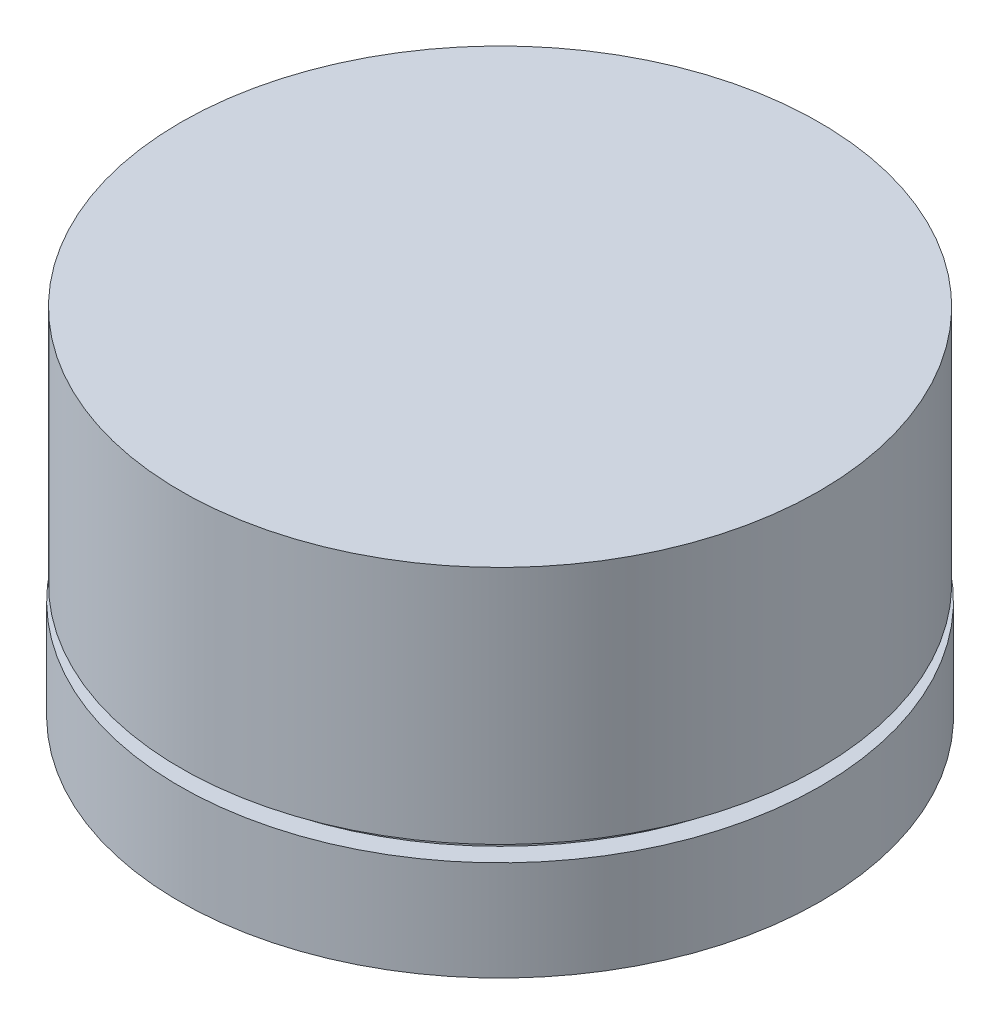
from build123d import *


with BuildPart() as part:
    # Sketch1 → Revolve1 (revolve)
    with BuildSketch(Plane.XY):
        Polygon((0, 19), (16, 19), (16, 6.978849502), (15.05011332, 6.978849502), (15.05011332, 6.228849502), (16.06413667, 6.228849502), (16.06413667, 1.228849502), (13, 1.228849502), (13, 4.228849502), (14.5, 4.228849502), (14.5, 8.228849502), (14, 8.228849502), (14, 18), (0, 18), align=None)
    revolve(axis=Axis((0, 0, 0), (0, 1, 0)))


solid = part.part
